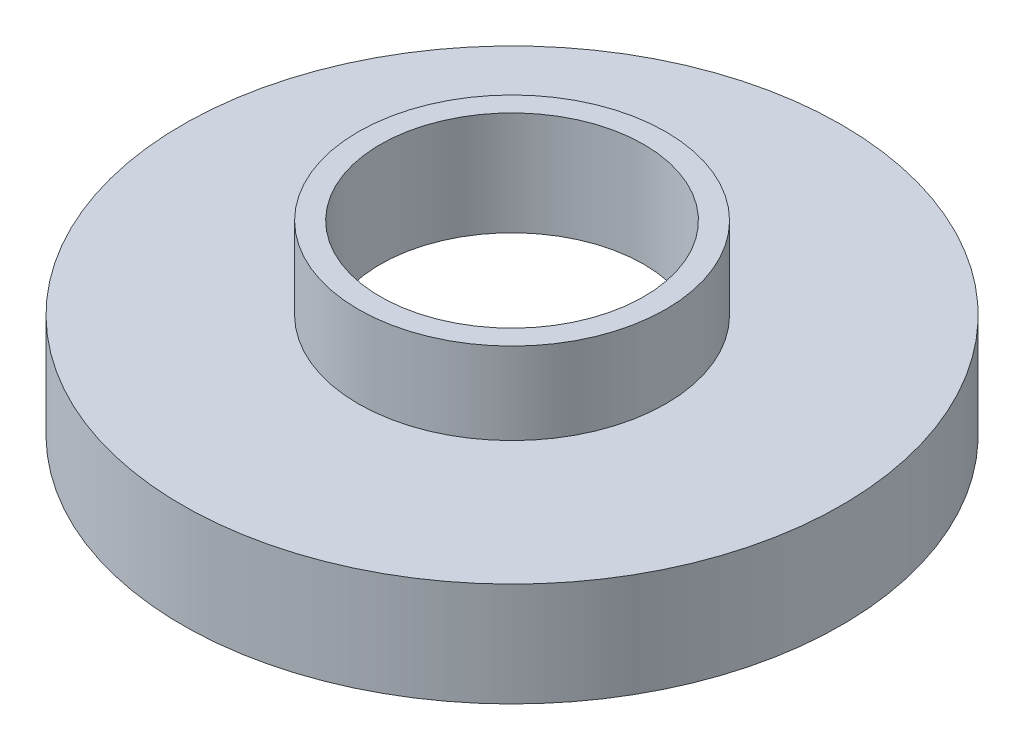
from build123d import *


with BuildPart() as part:
    # Sketch1 → Revolve1 (revolve)
    with BuildSketch(Plane.XY, mode=Mode.PRIVATE) as revolve1_sk:
        Polygon((19.05, 26.825), (19.05, 11.825), (44.45, 11.825), (44.45, 0), (47.625, 0), (47.625, 15), (22.225, 15), (22.225, 26.825), align=None)
    revolve(revolve1_sk.sketch.rotate(Axis((0, 0, 0), (0, 1, 0)), 90), axis=Axis((0, 0, 0), (0, 1, 0)))


solid = part.part
